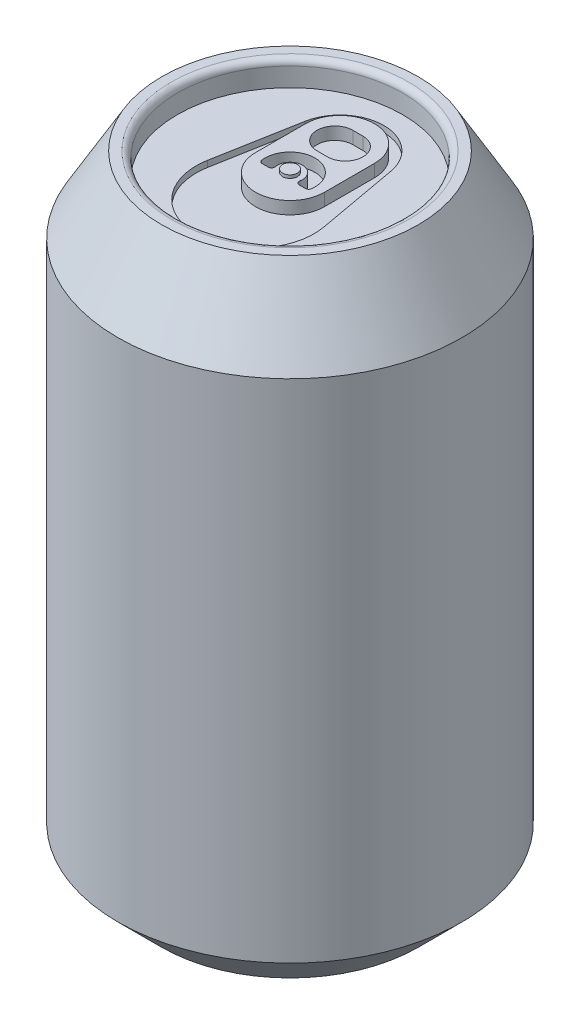
from build123d import *

# Parameters (mm, degrees)
SKETCH1_R           = 27.5
BOSS_EXTRUDE1_DEPTH = 100
CHAMFER1_SIZE       = 7
CHAMFER1_SIZE2      = 12.124355653
CHAMFER2_SIZE       = 7
SKETCH2_R           = 18
CUT_EXTRUDE1_DEPTH  = 4
FILLET1_R           = 1
CUT_EXTRUDE2_DEPTH  = 1
SKETCH6_R           = 2
BOSS_EXTRUDE2_DEPTH = 2
FILLET2_R           = 0.5
SKETCH7_R           = 1.185349533
BOSS_EXTRUDE3_DEPTH = 0.5


with BuildPart() as part:
    # Sketch1 → Boss-Extrude1 (new body)
    with BuildSketch(Plane(origin=(0, 0, 0), x_dir=(1, 0, 0), z_dir=(0, 1, 0))):
        with Locations(Location((0, 0, 0), (0, 0, 270))):
            Circle(SKETCH1_R)
    extrude(amount=BOSS_EXTRUDE1_DEPTH)

    # Chamfer1
    chamfer1_edges = [part.edges().sort_by_distance(p)[0] for p in [
        (0, 100, -27.5),
    ]]
    chamfer1_side = [part.faces().sort_by_distance(p)[0] for p in [
        (0, 100, 0),
    ]]
    chamfer(chamfer1_edges, length=CHAMFER1_SIZE, length2=CHAMFER1_SIZE2, reference=chamfer1_side[0])

    # Chamfer2
    chamfer2_edges = [part.edges().sort_by_distance(p)[0] for p in [
        (0, 0, -27.5),
    ]]
    chamfer(chamfer2_edges, length=CHAMFER2_SIZE)

    # Sketch2 → Cut-Extrude1 (cut)
    with BuildSketch(Plane(origin=(0, 100, 0), x_dir=(1, 0, 0), z_dir=(0, 1, 0))):
        with Locations(Location((0, 0, 0), (0, 0, 270))):
            Circle(SKETCH2_R)
    extrude(amount=-CUT_EXTRUDE1_DEPTH, mode=Mode.SUBTRACT)

    # Fillet1
    fillet1_edges = [part.edges().sort_by_distance(p)[0] for p in [
        (0, 100, -18),
    ]]
    fillet(fillet1_edges, radius=FILLET1_R)

    # Sketch4 → Cut-Extrude2 (cut)
    with BuildSketch(Plane(origin=(0, 96, 0), x_dir=(1, 0, 0), z_dir=(0, 1, 0))):
        with BuildLine():
            ThreePointArc((-9.270739516, -3.897699019), (0, -15), (9.270739516, -3.897699019))
            Line((9.270739516, -3.897699019), (6.887755938, 9.248526385))
            ThreePointArc((6.887755938, 9.248526385), (0, 15), (-6.887755938, 9.248526385))
            Line((-6.887755938, 9.248526385), (-9.270739516, -3.897699019))
        make_face()
    extrude(amount=-CUT_EXTRUDE2_DEPTH, mode=Mode.SUBTRACT)

    # Sketch6 → Boss-Extrude2 (add)
    # profile 1 of 2: a face of its own
    with BuildSketch(Plane(origin=(0, 95, 0), x_dir=(1, 0, 0), z_dir=(0, 1, 0))):
        with BuildLine():
            Line((-5.5, 8), (-5.5, 0))
            ThreePointArc((-5.5, 0), (0, -5.5), (5.5, 0))
            Line((5.5, 0), (5.5, 8))
            ThreePointArc((5.5, 8), (0, 13.5), (-5.5, 8))
        make_face()
        with BuildLine():
            Line((3.872983346, -1), (1.732050808, -1))
            ThreePointArc((1.732050808, -1), (0, -2), (-1.732050808, -1))
            Line((-1.732050808, -1), (-3.872983346, -1))
            ThreePointArc((-3.872983346, -1), (0, 4), (3.872983346, -1))
        make_face(mode=Mode.SUBTRACT)
        with BuildLine():
            ThreePointArc((-0.824231798, 5.146617712), (-3.677614086, 8), (-0.824231798, 10.853382288))
            Line((-0.824231798, 10.853382288), (0.824231798, 10.853382288))
            ThreePointArc((0.824231798, 10.853382288), (3.677614086, 8), (0.824231798, 5.146617712))
            Line((0.824231798, 5.146617712), (-0.824231798, 5.146617712))
        make_face(mode=Mode.SUBTRACT)
    # profile 2 of 2: a face of its own
    with BuildSketch(Plane(origin=(0, 95, 0), x_dir=(1, 0, 0), z_dir=(0, 1, 0))):
        Circle(SKETCH6_R)
    extrude(amount=BOSS_EXTRUDE2_DEPTH)

    # Fillet2
    fillet2_edges = [part.edges().sort_by_distance(p)[0] for p in [
        (-3.872983346, 96, 1),
        (3.872983346, 96, 1),
        (1.732050808, 96, 1),
        (-1.732050808, 96, 1),
    ]]
    fillet(fillet2_edges, radius=FILLET2_R)

    # Sketch7 → Boss-Extrude3 (add)
    with BuildSketch(Plane(origin=(0, 97, 0), x_dir=(1, 0, 0), z_dir=(0, 1, 0))):
        with Locations(Location((0, 0, 0), (0, 0, 270))):
            Circle(SKETCH7_R)
    extrude(amount=BOSS_EXTRUDE3_DEPTH)


solid = part.part
